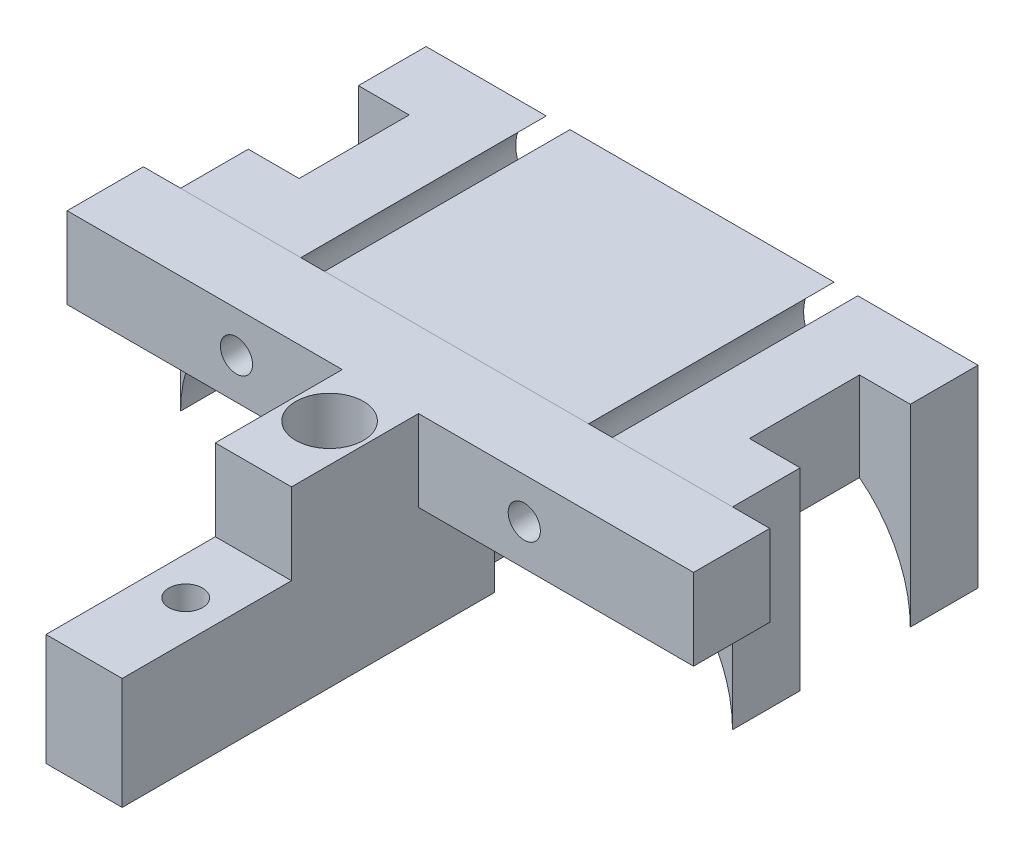
from build123d import *

# Parameters (mm, degrees)
SKETCH_2_W          = 37
SKETCH_2_H          = 4.8
SKETCH_2_R          = 0.95
EXTRUDE_1_DEPTH     = 4
EXTRUDE_2_DEPTH     = 11.4
SKETCH_4_R          = 7.8
CUT_EXTRUDE_1_DEPTH = 15
SKETCH_5_R          = 2.5
CUT_EXTRUDE_2_DEPTH = 15
SKETCH_6_W          = 4.5
SKETCH_6_H          = 11.4
EXTRUDE_3_DEPTH     = 22
SKETCH_7_W          = 37
SKETCH_7_H          = 4.8
SKETCH_7_R          = 0.95
EXTRUDE_4_DEPTH     = 0.5
SKETCH_8_W          = 4.5
SKETCH_8_H          = 10
CUT_EXTRUDE_3_DEPTH = 4.8
SKETCH_9_R          = 0.95
CUT_EXTRUDE_4_DEPTH = 20
SKETCH_10_R         = 2
CUT_EXTRUDE_8_DEPTH = 3
SKETCH_11_R         = 1
CUT_EXTRUDE_9_DEPTH = 13


with BuildPart() as part:
    # 草图2 → 凸台-拉伸1 (new body)
    with BuildSketch(Plane.XY):
        with Locations((18.5, -2.4)):
            Rectangle(SKETCH_2_W, SKETCH_2_H)
        with Locations((10, -2.4)):
            Circle(SKETCH_2_R, mode=Mode.SUBTRACT)
        with Locations((27, -2.4)):
            Circle(SKETCH_2_R, mode=Mode.SUBTRACT)
    extrude(amount=EXTRUDE_1_DEPTH)

    # 草图6 → 凸台-拉伸3 (add)
    with BuildSketch(Plane.XY):
        with Locations((18.5, -5.7)):
            Rectangle(SKETCH_6_W, SKETCH_6_H)
    extrude(amount=EXTRUDE_3_DEPTH)

    # 草图7 → 凸台-拉伸4 (add)
    with BuildSketch(Plane.XY.offset(4)):
        with Locations((18.5, -2.4)):
            Rectangle(SKETCH_7_W, SKETCH_7_H)
        with Locations((10, -2.4)):
            Circle(SKETCH_7_R, mode=Mode.SUBTRACT)
        with Locations((27, -2.4)):
            Circle(SKETCH_7_R, mode=Mode.SUBTRACT)
    extrude(amount=EXTRUDE_4_DEPTH)

    # 草图8 → 切除-拉伸3 (cut)
    with BuildSketch(Plane(origin=(0, 0, 0), x_dir=(1, 0, 0), z_dir=(0, 1, 0))):
        with Locations((18.5, -17)):
            Rectangle(SKETCH_8_W, SKETCH_8_H)
    extrude(amount=-CUT_EXTRUDE_3_DEPTH, mode=Mode.SUBTRACT)

    # 草图9 → 切除-拉伸4 (cut)
    with BuildSketch(Plane(origin=(0, 0, 0), x_dir=(1, 0, 0), z_dir=(0, 1, 0))):
        with Locations(Location((18.5, -7.5, 0), (0, 0, 180))):
            Circle(SKETCH_9_R)
    extrude(amount=-CUT_EXTRUDE_4_DEPTH, mode=Mode.SUBTRACT)

    # 草图10 → 切除-拉伸8 (cut)
    with BuildSketch(Plane(origin=(0, 0, 0), x_dir=(1, 0, 0), z_dir=(0, 1, 0))):
        with Locations(Location((18.5, -7.5, 0), (0, 0, 180))):
            Circle(SKETCH_10_R)
    extrude(amount=-CUT_EXTRUDE_8_DEPTH, mode=Mode.SUBTRACT)

    # 草图11 → 切除-拉伸9 (cut)
    with BuildSketch(Plane(origin=(0, -4.8, 0), x_dir=(1, 0, 0), z_dir=(0, 1, 0))):
        with Locations(Location((18.5, -16, 0), (0, 0, 180))):
            Circle(SKETCH_11_R)
    extrude(amount=-CUT_EXTRUDE_9_DEPTH, mode=Mode.SUBTRACT)


with BuildPart() as body_2:
    # 草图3 → 凸台-拉伸2 (new body)
    with BuildSketch(Plane(origin=(0, 0, 0), x_dir=(1, 0, 0), z_dir=(0, 1, 0))):
        Polygon((2.2, 0), (2.2, 4), (5.2, 4), (5.2, 10.5), (2.2, 10.5), (2.2, 14.5), (34.8, 14.5), (34.8, 10.5), (31.8, 10.5), (31.8, 4), (34.8, 4), (34.8, 0), align=None)
    extrude(amount=-EXTRUDE_2_DEPTH)

    # 草图4 → 切除-拉伸1 (cut)
    with BuildSketch(Plane.XY):
        with Locations((10, -11.4)):
            Circle(SKETCH_4_R)
        with Locations((27, -11.4)):
            Circle(SKETCH_4_R)
    extrude(amount=-CUT_EXTRUDE_1_DEPTH, mode=Mode.SUBTRACT)

    # 草图5 → 切除-拉伸2 (cut)
    with BuildSketch(Plane.XY):
        with Locations((10, -2.4)):
            Circle(SKETCH_5_R)
        with Locations((27, -2.4)):
            Circle(SKETCH_5_R)
    extrude(amount=-CUT_EXTRUDE_2_DEPTH, mode=Mode.SUBTRACT)


with BuildPart() as cut_extrude_2_piece_1:
    # of the separate pieces the step leaves, piece 1, a body of its own (cut_extrude_2_pieces)
    add(body_2.part.solids().sort_by_distance((26.3, 0, 0))[0])


with BuildPart() as cut_extrude_2_piece_2:
    # of the separate pieces the step leaves, piece 2, a body of its own (cut_extrude_2_pieces)
    add(body_2.part.solids().sort_by_distance((2.2, 0, 0))[0])


with BuildPart() as cut_extrude_2_piece_3:
    # of the separate pieces the step leaves, piece 3, a body of its own (cut_extrude_2_pieces)
    add(body_2.part.solids().sort_by_distance((34.8, 0, 0))[0])


solid = Compound([part.part, cut_extrude_2_piece_1.part, cut_extrude_2_piece_2.part, cut_extrude_2_piece_3.part])
